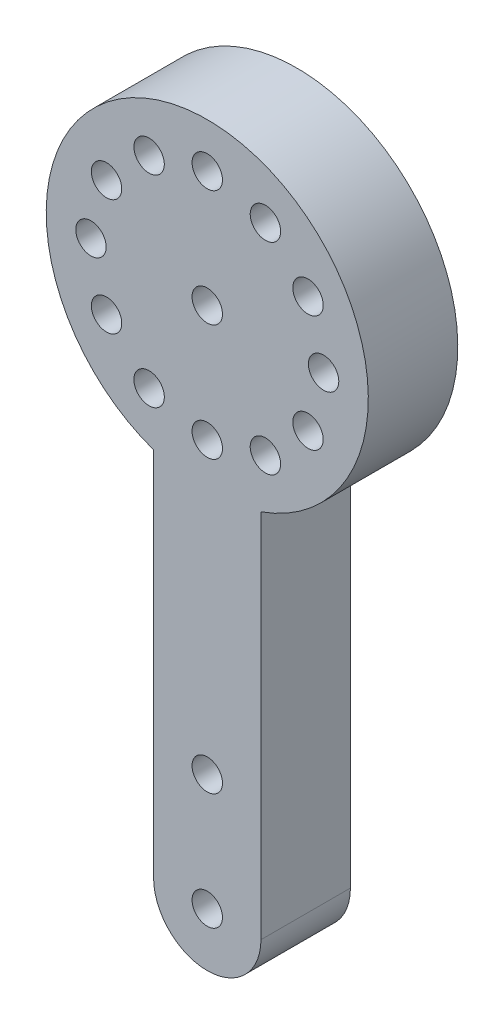
from build123d import *

# Parameters (mm, degrees)
SKETCH1_R           = 1.7
BOSS_EXTRUDE1_DEPTH = 5


with BuildPart() as part:
    # Sketch1 → Boss-Extrude1 (new, symmetric)
    with BuildSketch(Plane.XY):
        with BuildLine():
            Line((-6, 9.245e-06), (-5.999970251, 41.417257276))
            ThreePointArc((-5.999970251, 41.417257276), (-3.1553e-05, 76.387830542), (6.000029749, 41.417278312))
            Line((6.000029749, 41.417278312), (6, -1.1791e-05))
            ThreePointArc((6, -1.1791e-05), (-1.0518e-05, -6), (-6, 9.245e-06))
        make_face()
        Circle(SKETCH1_R, mode=Mode.SUBTRACT)
        with Locations((0, 13)):
            Circle(SKETCH1_R, mode=Mode.SUBTRACT)
        with Locations((0, 58.387830542)):
            Circle(SKETCH1_R, mode=Mode.SUBTRACT)
        with Locations((0, 45.387830542)):
            Circle(SKETCH1_R, mode=Mode.SUBTRACT)
        with Locations((-6.5, 47.129500293)):
            Circle(SKETCH1_R, mode=Mode.SUBTRACT)
        with Locations((-11.258330249, 51.887830542)):
            Circle(SKETCH1_R, mode=Mode.SUBTRACT)
        with Locations((-13, 58.387830542)):
            Circle(SKETCH1_R, mode=Mode.SUBTRACT)
        with Locations((-11.258330249, 64.887830542)):
            Circle(SKETCH1_R, mode=Mode.SUBTRACT)
        with Locations((-6.5, 69.646160791)):
            Circle(SKETCH1_R, mode=Mode.SUBTRACT)
        with Locations((0, 71.387830542)):
            Circle(SKETCH1_R, mode=Mode.SUBTRACT)
        with Locations((6.5, 69.646160791)):
            Circle(SKETCH1_R, mode=Mode.SUBTRACT)
        with Locations((11.258330249, 64.887830542)):
            Circle(SKETCH1_R, mode=Mode.SUBTRACT)
        with Locations((13, 58.387830542)):
            Circle(SKETCH1_R, mode=Mode.SUBTRACT)
        with Locations((11.258330249, 51.887830542)):
            Circle(SKETCH1_R, mode=Mode.SUBTRACT)
        with Locations((6.5, 47.129500293)):
            Circle(SKETCH1_R, mode=Mode.SUBTRACT)
    extrude(amount=BOSS_EXTRUDE1_DEPTH, both=True)


solid = part.part
